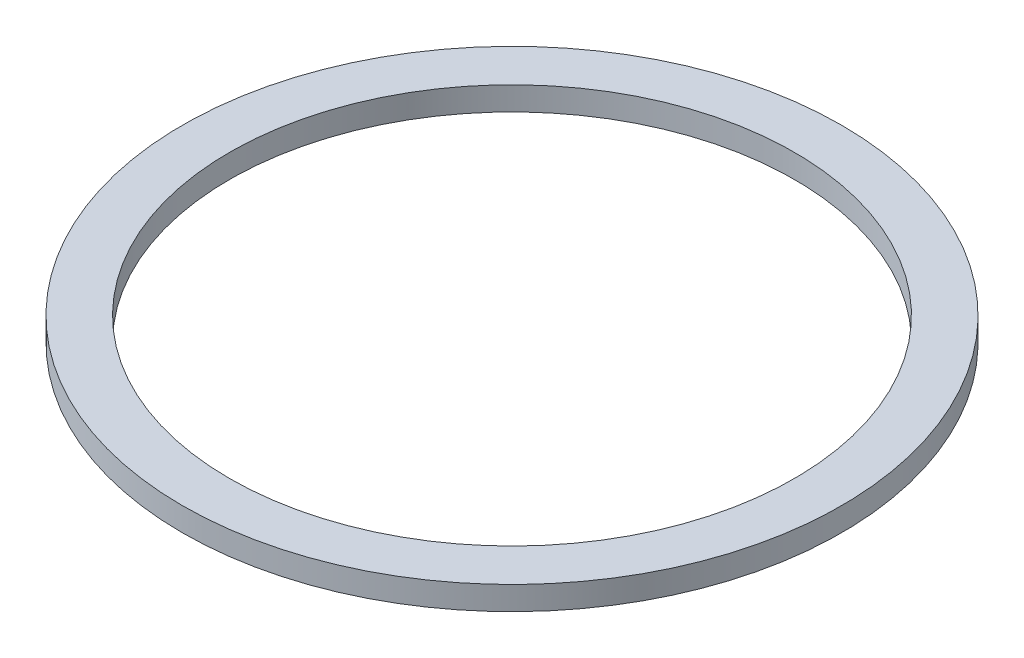
from build123d import *

# Parameters (mm, degrees)
SKETCH1_R           = 7
SKETCH1_R_2         = 6
BOSS_EXTRUDE1_DEPTH = 0.25


with BuildPart() as part:
    # Sketch1 → Boss-Extrude1 (new, symmetric)
    with BuildSketch(Plane(origin=(0, 0, 0), x_dir=(1, 0, 0), z_dir=(0, 1, 0))):
        with Locations(Location((0, 0, 0), (0, 0, 270))):
            Circle(SKETCH1_R)
        with Locations(Location((0, 0, 0), (0, 0, 270))):
            Circle(SKETCH1_R_2, mode=Mode.SUBTRACT)
    extrude(amount=BOSS_EXTRUDE1_DEPTH, both=True)


solid = part.part
